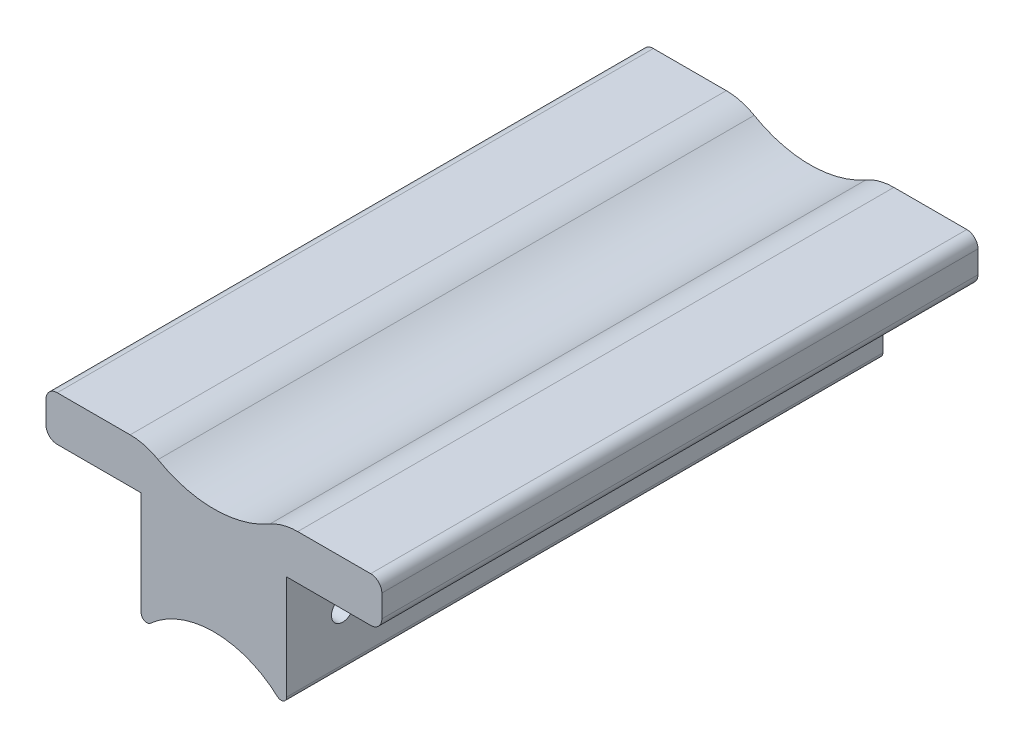
from build123d import *

# Parameters (mm, degrees)
AUFSATZ_LINEAR_AUSTRAGEN1_DEPTH = 106.5
SKIZZE2_R                       = 20
SCHNITT_LINEAR_AUSTRAGEN1_DEPTH = 118.653091757
VERRUNDUNG1_R                   = 10
VERRUNDUNG2_R                   = 2
VERRUNDUNG3_R                   = 1
SKIZZE3_R                       = 2
SCHNITT_LINEAR_AUSTRAGEN2_DEPTH = 122.619283011


with BuildPart() as part:
    # Skizze1 → Aufsatz-Linear austragen1 (new body)
    with BuildSketch(Plane.XY):
        with BuildLine():
            Line((-30, 32), (-13, 32))
            Line((-13, 32), (-13, 10.95445115))
            ThreePointArc((-13, 10.95445115), (0, 17), (13, 10.95445115))
            Line((13, 10.95445115), (13, 32))
            Line((13, 32), (30, 32))
            Line((30, 32), (30, 40))
            Line((30, 40), (-30, 40))
            Line((-30, 40), (-30, 32))
        make_face()
    extrude(amount=AUFSATZ_LINEAR_AUSTRAGEN1_DEPTH)

    # Skizze2 → Schnitt-Linear austragen1 (cut, through all)
    with BuildSketch(Plane(origin=(0, 0, 0), x_dir=(-1, 0, 0), z_dir=(0, 0, -1))):
        with Locations((0, 56)):
            Circle(SKIZZE2_R)
    extrude(amount=-SCHNITT_LINEAR_AUSTRAGEN1_DEPTH, mode=Mode.SUBTRACT)

    # Verrundung1
    verrundung1_edges = [part.edges().sort_by_distance(p)[0] for p in [
        (-12, 40, 53.25),
        (12, 40, 53.25),
    ]]
    fillet(verrundung1_edges, radius=VERRUNDUNG1_R)

    # Verrundung2
    verrundung2_edges = [part.edges().sort_by_distance(p)[0] for p in [
        (-30, 40, 53.25),
        (30, 40, 53.25),
        (30, 32, 53.25),
        (-30, 32, 53.25),
    ]]
    fillet(verrundung2_edges, radius=VERRUNDUNG2_R)

    # Verrundung3
    verrundung3_edges = [part.edges().sort_by_distance(p)[0] for p in [
        (13, 10.95445115, 53.25),
        (-13, 10.95445115, 53.25),
    ]]
    fillet(verrundung3_edges, radius=VERRUNDUNG3_R)

    # Skizze3 → Schnitt-Linear austragen2 (cut, through all)
    with BuildSketch(Plane(origin=(13, 0, 0), x_dir=(0, 0, -1), z_dir=(1, 0, 0))):
        with Locations(Location((-10, 22, 0), (0, 0, 90))):
            Circle(SKIZZE3_R)
        with Locations(Location((-96.5, 22, 0), (0, 0, 90))):
            Circle(SKIZZE3_R)
    extrude(amount=-SCHNITT_LINEAR_AUSTRAGEN2_DEPTH, mode=Mode.SUBTRACT)


solid = part.part
